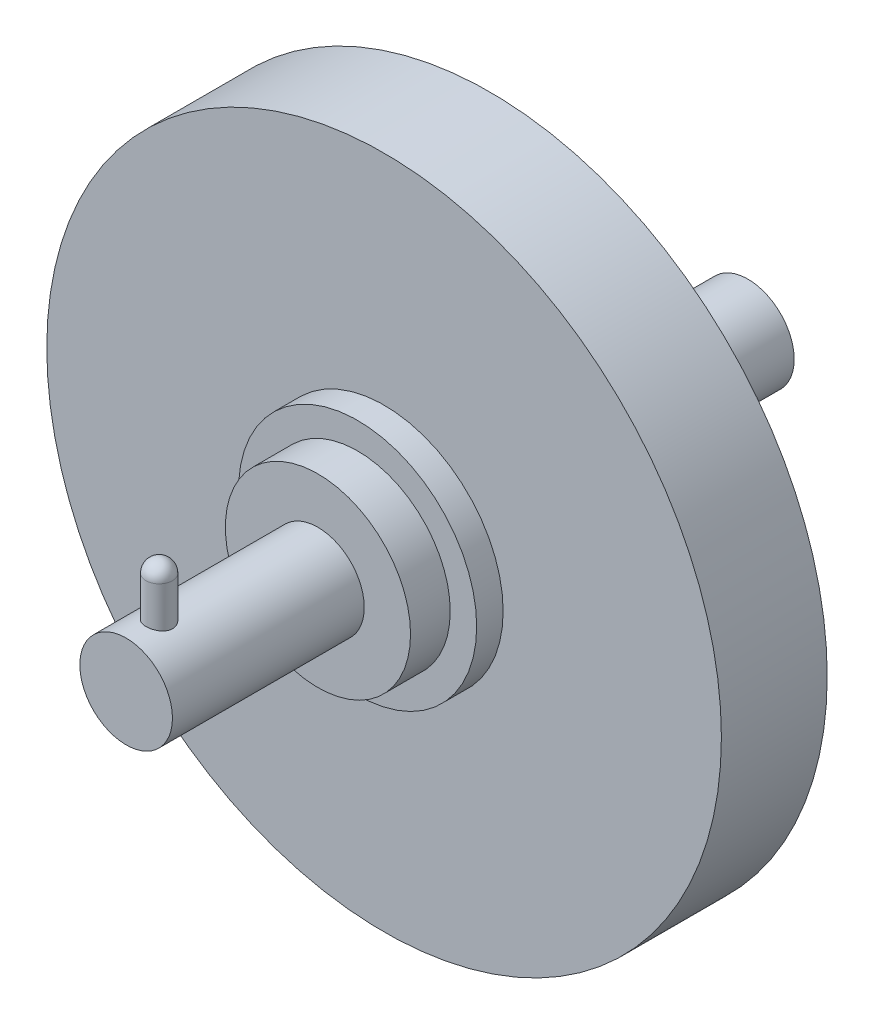
from build123d import *

# Parameters (mm, degrees)
SKETCH1_R                = 323.85
BOSS_EXTRUDE3_DEPTH      = 101.6
BOSS_EXTRUDE4_DEPTH      = 25.4
BOSS_EXTRUDE4_DEPTH_BACK = 127
SKETCH2_R                = 114.3
BOSS_EXTRUDE5_DEPTH      = 38.1
BOSS_EXTRUDE5_DEPTH_BACK = 190.5
SKETCH4_R                = 88.9
BOSS_EXTRUDE6_DEPTH      = 184.15
BOSS_EXTRUDE6_DEPTH_BACK = 412.75
SKETCH5_R                = 44.45
BOSS_EXTRUDE7_DEPTH      = 50.8
BOSS_EXTRUDE7_DEPTH_BACK = 25.4
SKETCH6_R                = 12.7
FILLET2_R                = 12.7


with BuildPart() as part:
    # Sketch1 → Boss-Extrude3 (new body)
    with BuildSketch(Plane.XY):
        Circle(SKETCH1_R)
    extrude(amount=BOSS_EXTRUDE3_DEPTH)

    # Sketch2 → Boss-Extrude4 (add, two sides: drawn at the far end of the back side and taken through both)
    with BuildSketch(Plane.XY.offset(101.6).offset(-BOSS_EXTRUDE4_DEPTH_BACK)):
        Circle(SKETCH2_R)
    extrude(amount=BOSS_EXTRUDE4_DEPTH + BOSS_EXTRUDE4_DEPTH_BACK)

    # Sketch4 → Boss-Extrude5 (add, two sides: drawn at the far end of the back side and taken through both)
    with BuildSketch(Plane.XY.offset(127).offset(-BOSS_EXTRUDE5_DEPTH_BACK)):
        Circle(SKETCH4_R)
    extrude(amount=BOSS_EXTRUDE5_DEPTH + BOSS_EXTRUDE5_DEPTH_BACK)

    # Sketch5 → Boss-Extrude6 (add, two sides: drawn at the far end of the back side and taken through both)
    with BuildSketch(Plane.XY.offset(165.1).offset(-BOSS_EXTRUDE6_DEPTH_BACK)):
        Circle(SKETCH5_R)
    extrude(amount=BOSS_EXTRUDE6_DEPTH + BOSS_EXTRUDE6_DEPTH_BACK)

    # Sketch6 → Boss-Extrude7 (add, two sides: drawn at the far end of the back side and taken through both)
    with BuildSketch(Plane(origin=(0, 44.45, 0), x_dir=(1, 0, 0), z_dir=(0, 1, 0)).offset(-BOSS_EXTRUDE7_DEPTH_BACK)):
        with Locations(Location((0, -317.5, 0), (0, 0, 270))):
            Circle(SKETCH6_R)
    extrude(amount=BOSS_EXTRUDE7_DEPTH + BOSS_EXTRUDE7_DEPTH_BACK)

    # Fillet2
    fillet2_edges = [part.edges().sort_by_distance(p)[0] for p in [
        (0, 95.25, 304.8),
    ]]
    fillet(fillet2_edges, radius=FILLET2_R)


solid = part.part
